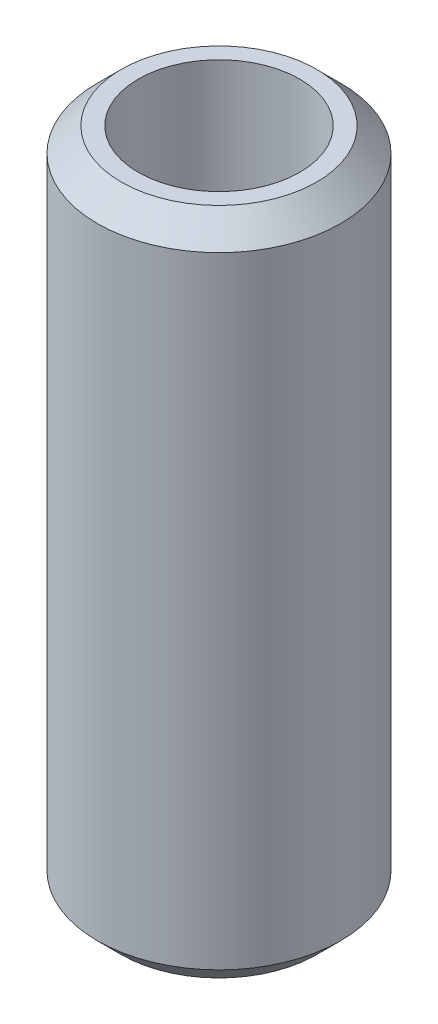
from build123d import *

# Parameters (mm, degrees)
SKETCH2_R           = 12.7
SKETCH2_R_2         = 8.433976834
BOSS_EXTRUDE1_DEPTH = 34.925
CHAMFER1_SIZE       = 2.5


with BuildPart() as part:
    # Sketch2 → Boss-Extrude1 (new, symmetric)
    with BuildSketch(Plane(origin=(0, 0, 0), x_dir=(1, 0, 0), z_dir=(0, 1, 0))):
        with Locations(Location((0, 0, 0), (0, 0, 270))):
            Circle(SKETCH2_R)
        with Locations(Location((0, 0, 0), (0, 0, 270))):
            Circle(SKETCH2_R_2, mode=Mode.SUBTRACT)
    extrude(amount=BOSS_EXTRUDE1_DEPTH, both=True)

    # Chamfer1
    chamfer1_edges = [part.edges().sort_by_distance(p)[0] for p in [
        (0, -34.925, -12.7),
        (0, 34.925, -12.7),
    ]]
    chamfer(chamfer1_edges, length=CHAMFER1_SIZE)


solid = part.part
